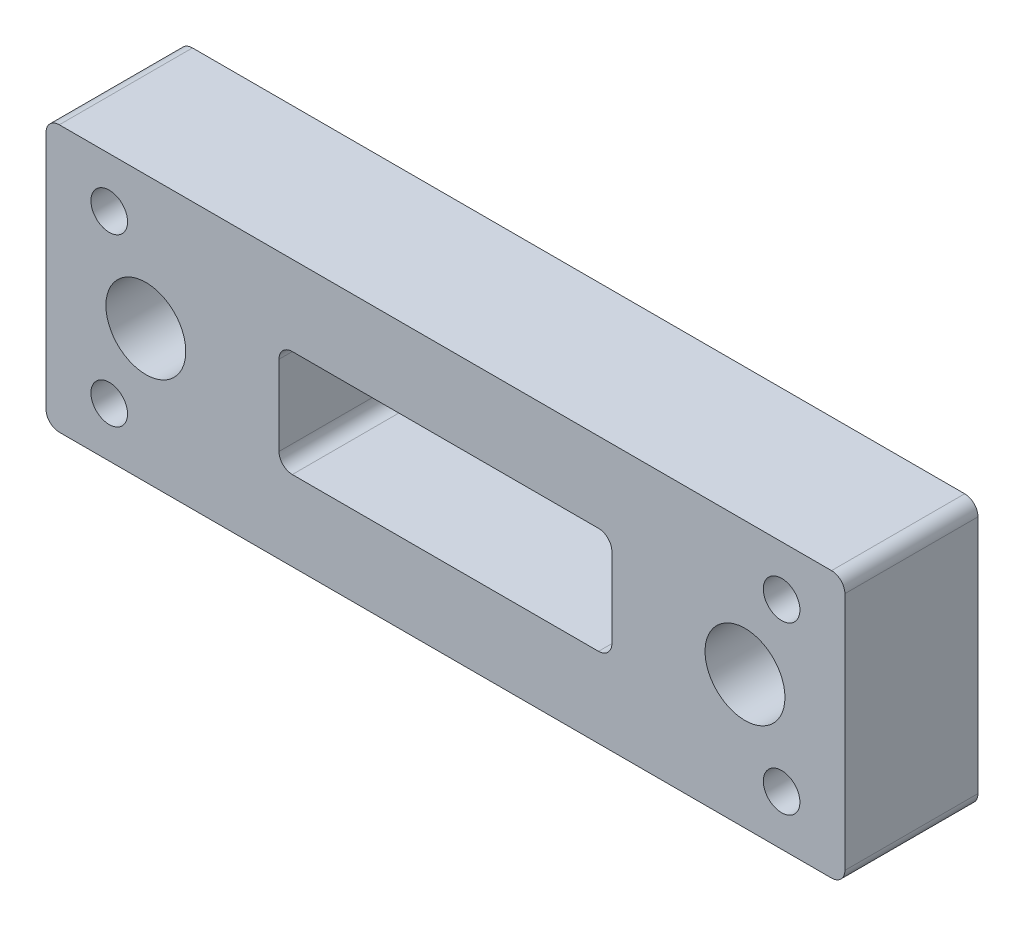
from build123d import *

# Parameters (mm, degrees)
SKETCH_1_W          = 120
SKETCH_1_H          = 40
EXTRUDE_1_DEPTH     = 20
SKETCH_2_R          = 6
SKETCH_2_R_2        = 2.75
CUT_EXTRUDE_1_DEPTH = 20
FILLET_1_R          = 2
SKETCH_3_W          = 50
SKETCH_3_H          = 16
CUT_EXTRUDE_2_DEPTH = 67.332495807
FILLET_2_R          = 2


with BuildPart() as part:
    # 草图1 → 凸台-拉伸1 (new body)
    with BuildSketch(Plane.XY):
        Rectangle(SKETCH_1_W, SKETCH_1_H)
    extrude(amount=EXTRUDE_1_DEPTH)

    # 草图2 → 切除-拉伸1 (cut)
    with BuildSketch(Plane.XY.offset(20)):
        with Locations((45, 0)):
            Circle(SKETCH_2_R)
        with Locations((50.5, 12.5)):
            Circle(SKETCH_2_R_2)
        with Locations(Location((50.5, -12.5, 0), (0, 0, 180))):
            Circle(SKETCH_2_R_2)
        with Locations((-50.5, -12.5)):
            Circle(SKETCH_2_R_2)
        with Locations(Location((-50.5, 12.5, 0), (0, 0, 180))):
            Circle(SKETCH_2_R_2)
        with Locations(Location((-45, 0, 0), (0, 0, 180))):
            Circle(SKETCH_2_R)
    extrude(amount=-CUT_EXTRUDE_1_DEPTH, mode=Mode.SUBTRACT)

    # 圆角1
    fillet_1_edges = [part.edges().sort_by_distance(p)[0] for p in [
        (-60, 20, 10),
        (60, 20, 10),
        (60, -20, 10),
        (-60, -20, 10),
    ]]
    fillet(fillet_1_edges, radius=FILLET_1_R)

    # 草图3 → 切除-拉伸2 (cut, through all)
    with BuildSketch(Plane.XY.offset(20)):
        Rectangle(SKETCH_3_W, SKETCH_3_H)
    extrude(amount=-CUT_EXTRUDE_2_DEPTH, mode=Mode.SUBTRACT)

    # 圆角2
    fillet_2_edges = [part.edges().sort_by_distance(p)[0] for p in [
        (-25, -8, 10),
        (-25, 8, 10),
        (25, 8, 10),
        (25, -8, 10),
    ]]
    fillet(fillet_2_edges, radius=FILLET_2_R)


solid = part.part
